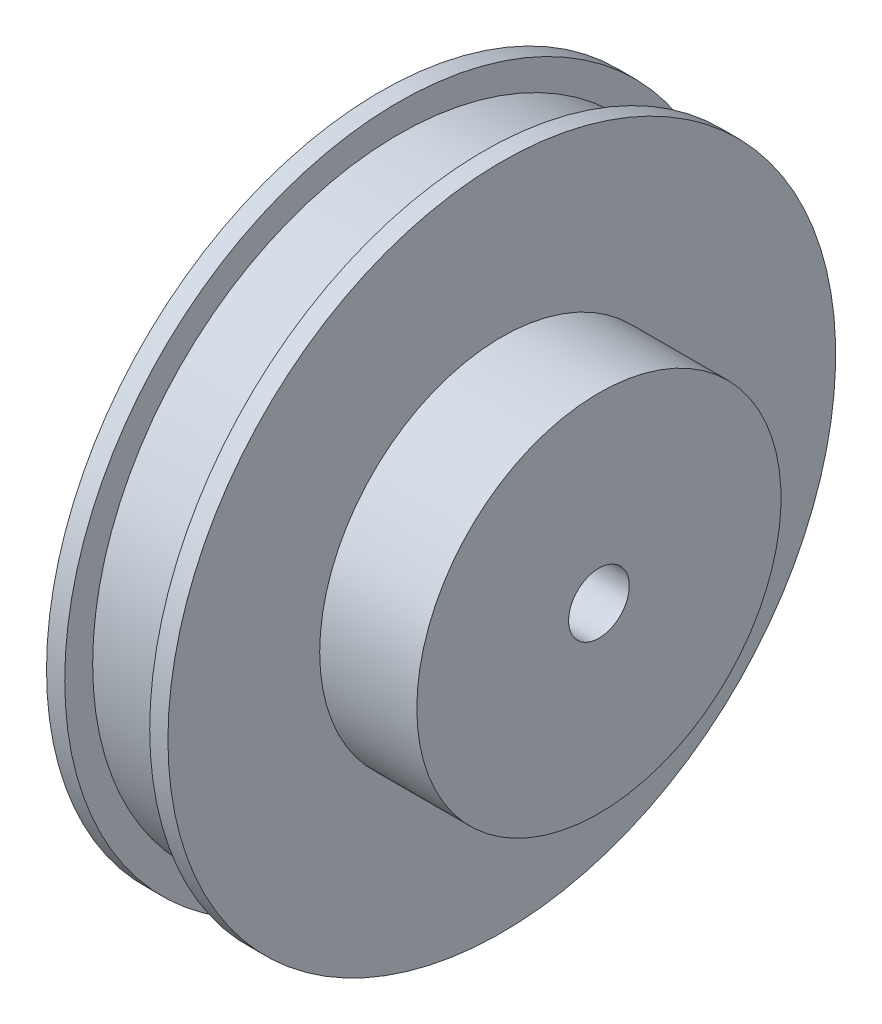
from build123d import *


with BuildPart() as part:
    # Sketch1 → Revolve1 (revolve)
    with BuildSketch(Plane.XY, mode=Mode.PRIVATE) as revolve1_sk:
        Polygon((0, 2.5), (0, 27.5), (1.5, 27.5), (1.5, 25.2), (8.5, 25.2), (8.5, 27.5), (10, 27.5), (10, 15), (18, 15), (18, 2.5), align=None)
    revolve(revolve1_sk.sketch.rotate(Axis((-19.68195685, 0, 0), (1, 0, 0)), 90), axis=Axis((-19.68195685, 0, 0), (1, 0, 0)))


solid = part.part
